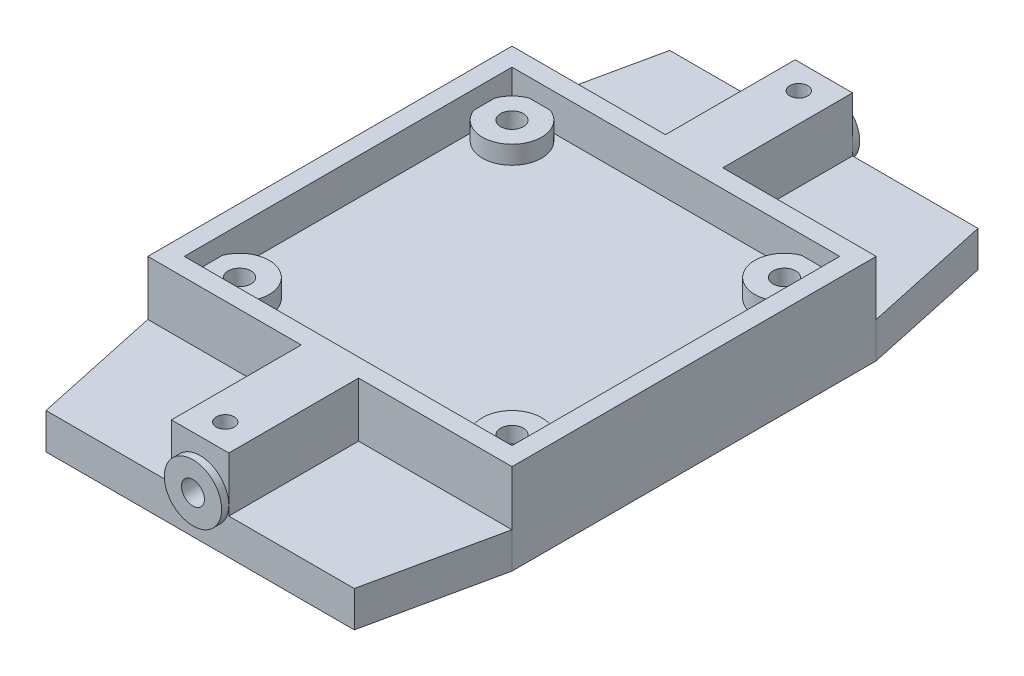
from build123d import *

# Parameters (mm, degrees)
SKETCH1_W            = 50.8
SKETCH1_H            = 50.8
SKETCH1_R            = 1.5875
BOSS_EXTRUDE1_DEPTH  = 2.54
SKETCH2_R            = 4.1275
SKETCH2_R_2          = 1.5875
BOSS_EXTRUDE2_DEPTH  = 2.54
SKETCH3_W            = 50.8
SKETCH3_H            = 50.8
SKETCH3_W_2          = 45.72
SKETCH3_H_2          = 45.72
BOSS_EXTRUDE3_DEPTH  = 5.08
SKETCH5_W            = 43
SKETCH5_H            = 87
SKETCH5_R            = 1
BOSS_EXTRUDE5_DEPTH  = 2
SKETCH6_R            = 3
SKETCH6_R_2          = 1
BOSS_EXTRUDE6_DEPTH  = 3
BOSS_EXTRUDE7_DEPTH  = 2
BOSS_EXTRUDE9_DEPTH  = 3
BOSS_EXTRUDE10_DEPTH = 2
SKETCH12_W           = 8
SKETCH12_H           = 18.1
BOSS_EXTRUDE12_DEPTH = 7.62
SKETCH13_R           = 1.6
CUT_EXTRUDE2_DEPTH   = 18.1
BOSS_EXTRUDE14_START = 18.1
BOSS_EXTRUDE14_DEPTH = 18.1
SKETCH14_R           = 4
SKETCH14_R_2         = 1.6
BOSS_EXTRUDE13_DEPTH = 1
SKETCH16_R           = 1.65
CUT_EXTRUDE6_DEPTH   = 19.1
SKETCH17_R           = 1.25
CUT_EXTRUDE7_DEPTH   = 6


with BuildPart() as part:
    # Sketch1 → Boss-Extrude1 (new body)
    with BuildSketch(Plane(origin=(0, 0, 0), x_dir=(1, 0, 0), z_dir=(0, 1, 0))):
        Rectangle(SKETCH1_W, SKETCH1_H)
        with Locations(Location((-19.0000001, 19.0000001, 0), (0, 0, 270))):
            Circle(SKETCH1_R, mode=Mode.SUBTRACT)
        with Locations(Location((19.0000001, 19.0000001, 0), (0, 0, 270))):
            Circle(SKETCH1_R, mode=Mode.SUBTRACT)
        with Locations(Location((19.0000001, -19.0000001, 0), (0, 0, 270))):
            Circle(SKETCH1_R, mode=Mode.SUBTRACT)
        with Locations(Location((-19.0000001, -19.0000001, 0), (0, 0, 270))):
            Circle(SKETCH1_R, mode=Mode.SUBTRACT)
    extrude(amount=BOSS_EXTRUDE1_DEPTH)

    # Sketch2 → Boss-Extrude2 (add)
    # profile 1 of 4: a face of its own
    with BuildSketch(Plane(origin=(0, 2.54, 0), x_dir=(1, 0, 0), z_dir=(0, 1, 0))):
        with Locations(Location((-19.0000001, 19.0000001, 0), (0, 0, 270))):
            Circle(SKETCH2_R)
        with Locations(Location((-19.0000001, 19.0000001, 0), (0, 0, 270))):
            Circle(SKETCH2_R_2, mode=Mode.SUBTRACT)
    # profile 2 of 4: a face of its own
    with BuildSketch(Plane(origin=(0, 2.54, 0), x_dir=(1, 0, 0), z_dir=(0, 1, 0))):
        with Locations(Location((19.0000001, 19.0000001, 0), (0, 0, 270))):
            Circle(SKETCH2_R)
        with Locations(Location((19.0000001, 19.0000001, 0), (0, 0, 270))):
            Circle(SKETCH2_R_2, mode=Mode.SUBTRACT)
    # profile 3 of 4: a face of its own
    with BuildSketch(Plane(origin=(0, 2.54, 0), x_dir=(1, 0, 0), z_dir=(0, 1, 0))):
        with Locations(Location((19.0000001, -19.0000001, 0), (0, 0, 270))):
            Circle(SKETCH2_R)
        with Locations(Location((19.0000001, -19.0000001, 0), (0, 0, 270))):
            Circle(SKETCH2_R_2, mode=Mode.SUBTRACT)
    # profile 4 of 4: a face of its own
    with BuildSketch(Plane(origin=(0, 2.54, 0), x_dir=(1, 0, 0), z_dir=(0, 1, 0))):
        with Locations(Location((-19.0000001, -19.0000001, 0), (0, 0, 270))):
            Circle(SKETCH2_R)
        with Locations(Location((-19.0000001, -19.0000001, 0), (0, 0, 270))):
            Circle(SKETCH2_R_2, mode=Mode.SUBTRACT)
    extrude(amount=BOSS_EXTRUDE2_DEPTH)

    # Sketch3 → Boss-Extrude3 (add)
    with BuildSketch(Plane(origin=(0, 2.54, 0), x_dir=(1, 0, 0), z_dir=(0, 1, 0))):
        Rectangle(SKETCH3_W, SKETCH3_H)
        Rectangle(SKETCH3_W_2, SKETCH3_H_2, mode=Mode.SUBTRACT)
    extrude(amount=BOSS_EXTRUDE3_DEPTH)

    # Sketch5 → Boss-Extrude5 (add)
    with BuildSketch(Plane(origin=(0, 0, 0), x_dir=(-1, 0, 0), z_dir=(0, -1, 0))):
        Rectangle(SKETCH5_W, SKETCH5_H)
        with Locations(Location((-15.5, -37.5, 0), (0, 0, 90))):
            Circle(SKETCH5_R, mode=Mode.SUBTRACT)
        with Locations(Location((15.5, -37.5, 0), (0, 0, 270))):
            Circle(SKETCH5_R, mode=Mode.SUBTRACT)
        with Locations(Location((-15.5, 37.5, 0), (0, 0, 270))):
            Circle(SKETCH5_R, mode=Mode.SUBTRACT)
        with Locations(Location((15.5, 37.5, 0), (0, 0, 90))):
            Circle(SKETCH5_R, mode=Mode.SUBTRACT)
    extrude(amount=BOSS_EXTRUDE5_DEPTH)

    # Sketch6 → Boss-Extrude6 (add)
    # profile 1 of 4: a face of its own
    with BuildSketch(Plane(origin=(0, -2, 0), x_dir=(-1, 0, 0), z_dir=(0, -1, 0))):
        with Locations(Location((15.5, -37.5, 0), (0, 0, 90))):
            Circle(SKETCH6_R)
        with Locations(Location((15.5, -37.5, 0), (0, 0, 270))):
            Circle(SKETCH6_R_2, mode=Mode.SUBTRACT)
    # profile 2 of 4: a face of its own
    with BuildSketch(Plane(origin=(0, -2, 0), x_dir=(-1, 0, 0), z_dir=(0, -1, 0))):
        with Locations(Location((-15.5, -37.5, 0), (0, 0, 270))):
            Circle(SKETCH6_R)
        with Locations(Location((-15.5, -37.5, 0), (0, 0, 270))):
            Circle(SKETCH6_R_2, mode=Mode.SUBTRACT)
    # profile 3 of 4: a face of its own
    with BuildSketch(Plane(origin=(0, -2, 0), x_dir=(-1, 0, 0), z_dir=(0, -1, 0))):
        with Locations(Location((-15.5, 37.5, 0), (0, 0, 90))):
            Circle(SKETCH6_R)
        with Locations(Location((-15.5, 37.5, 0), (0, 0, 270))):
            Circle(SKETCH6_R_2, mode=Mode.SUBTRACT)
    # profile 4 of 4: a face of its own
    with BuildSketch(Plane(origin=(0, -2, 0), x_dir=(-1, 0, 0), z_dir=(0, -1, 0))):
        with Locations(Location((15.5, 37.5, 0), (0, 0, 270))):
            Circle(SKETCH6_R)
        with Locations(Location((15.5, 37.5, 0), (0, 0, 270))):
            Circle(SKETCH6_R_2, mode=Mode.SUBTRACT)
    extrude(amount=BOSS_EXTRUDE6_DEPTH)

    # Sketch7 → Boss-Extrude7 (add)
    with BuildSketch(Plane.XZ):
        Polygon((21.5, 43.5), (21.5, -43.5), (25.4, -25.4), (25.4, 25.4), align=None)
        Polygon((-25.4, 25.4), (-21.5, 43.5), (-21.5, -43.5), (-25.4, -25.4), align=None)
    extrude(amount=BOSS_EXTRUDE7_DEPTH)

    # Sketch8 → Boss-Extrude9 (add)
    with BuildSketch(Plane.XZ.offset(2)):
        Polygon((21.5, 43.5), (-21.5, 43.5), (-25.4, 25.4), (-25.4, -25.4), (-21.5, -43.5), (21.5, -43.5), (25.4, -25.4), (25.4, 25.4), align=None)
        Polygon((19.885038785, 41.5), (-19.885038785, 41.5), (-23.4, 25.186974874), (-23.4, -25.186974874), (-19.885038785, -41.5), (19.885038785, -41.5), (23.4, -25.186974874), (23.4, 25.186974874), align=None, mode=Mode.SUBTRACT)
    extrude(amount=BOSS_EXTRUDE9_DEPTH)

    # Sketch9 → Boss-Extrude10 (add)
    with BuildSketch(Plane(origin=(0, 0, 0), x_dir=(1, 0, 0), z_dir=(0, 1, 0))):
        Polygon((21.5, -43.5), (25.4, -25.4), (-25.4, -25.4), (-21.5, -43.5), align=None)
        Polygon((21.5, 43.5), (-21.5, 43.5), (-25.4, 25.4), (25.4, 25.4), align=None)
    extrude(amount=-BOSS_EXTRUDE10_DEPTH)

    # Sketch12 → Boss-Extrude12 (add)
    with BuildSketch(Plane(origin=(0, 0, 0), x_dir=(1, 0, 0), z_dir=(0, 1, 0))):
        with Locations((0, 34.45)):
            Rectangle(SKETCH12_W, SKETCH12_H)
        with Locations((0, -34.45)):
            Rectangle(SKETCH12_W, SKETCH12_H)
    extrude(amount=BOSS_EXTRUDE12_DEPTH)

    # Sketch13 → Cut-Extrude2 (cut)
    with BuildSketch(Plane.XY.offset(43.5)):
        with Locations((0, 1.31)):
            Circle(SKETCH13_R)
    extrude(amount=-CUT_EXTRUDE2_DEPTH, mode=Mode.SUBTRACT)

    # Sketch15 → Boss-Extrude14 (add)
    with BuildSketch(Plane.XY.offset(25.4).offset(BOSS_EXTRUDE14_START)):
        with BuildLine():
            ThreePointArc((1.161895004, 2.41), (0, 2.91), (-1.161895004, 2.41))
            Line((-1.161895004, 2.41), (1.161895004, 2.41))
        make_face()
    extrude(amount=-BOSS_EXTRUDE14_DEPTH)

    # Sketch14 → Boss-Extrude13 (add)
    with BuildSketch(Plane(origin=(0, 0, -43.5), x_dir=(-1, 0, 0), z_dir=(0, 0, -1))):
        with Locations((0, 1.31)):
            Circle(SKETCH14_R)
        with Locations((0, 1.31)):
            Circle(SKETCH14_R_2, mode=Mode.SUBTRACT)
    boss_extrude13 = extrude(amount=BOSS_EXTRUDE13_DEPTH)

    # Mirror4: Boss-Extrude13 across plane
    add(boss_extrude13.mirror(Plane.XY))

    # Sketch16 → Cut-Extrude6 (cut)
    with BuildSketch(Plane(origin=(0, 0, -44.5), x_dir=(-1, 0, 0), z_dir=(0, 0, -1))):
        with Locations((0, 1.31)):
            Circle(SKETCH16_R)
    extrude(amount=-CUT_EXTRUDE6_DEPTH, mode=Mode.SUBTRACT)

    # Sketch17 → Cut-Extrude7 (cut)
    with BuildSketch(Plane(origin=(0, 7.62, 0), x_dir=(1, 0, 0), z_dir=(0, 1, 0))):
        with Locations(Location((0, 40, 0), (0, 0, 270))):
            Circle(SKETCH17_R)
    cut_extrude7 = extrude(amount=-CUT_EXTRUDE7_DEPTH, mode=Mode.SUBTRACT)

    # Mirror5: Cut-Extrude7 across plane
    add(cut_extrude7.mirror(Plane.XY), mode=Mode.SUBTRACT)


solid = part.part
